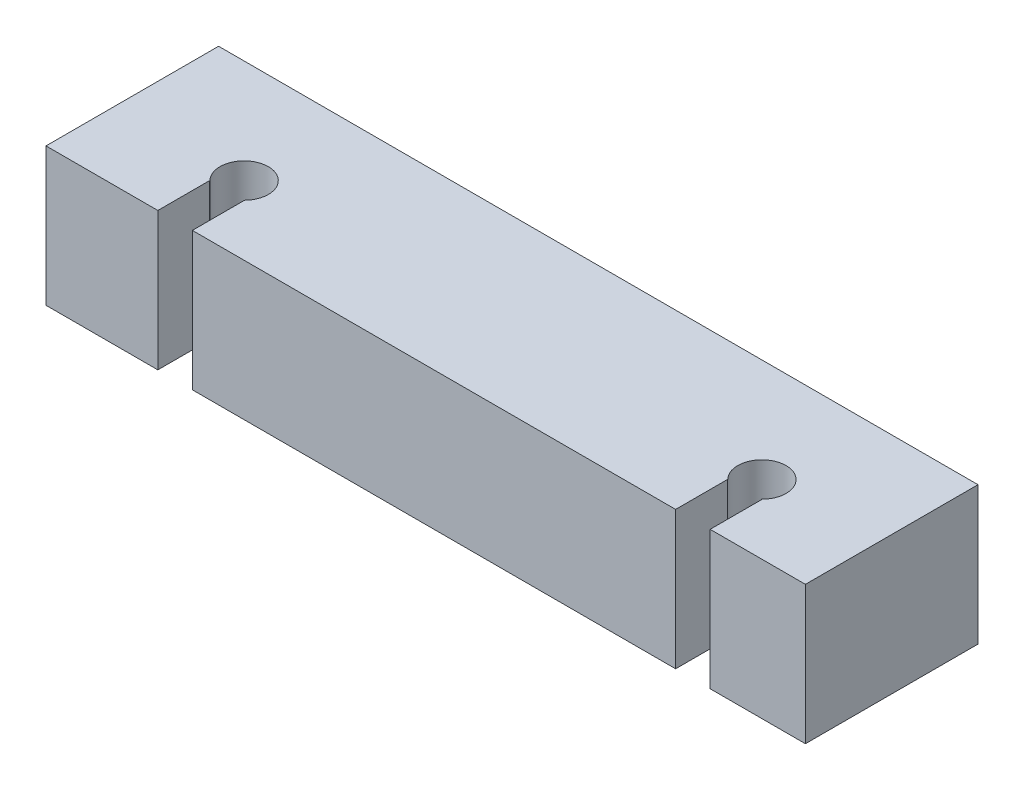
from build123d import *

# Parameters (mm, degrees)
SKETCH1_R               = 72.5
SKETCH1_R_2             = 62.5
BOSS_EXTRUDE1_DEPTH     = 10
SKETCH2_W               = 25
SKETCH2_H               = 10
BOSS_EXTRUDE2_DEPTH     = 100
SKETCH3_W               = 145
SKETCH3_H               = 50
BOSS_EXTRUDE3_DEPTH     = 10
CUT_EXTRUDE1_START      = -10
SKETCH4_R               = 62.5
CUT_EXTRUDE1_DEPTH      = 10
SKETCH5_W               = 145
SKETCH5_H               = 12.5
BOSS_EXTRUDE4_DEPTH     = 50
CUT_EXTRUDE2_DEPTH      = 138.318061449
CUT_EXTRUDE2_DEPTH_BACK = 138.318061449
SKETCH6_R               = 1.75
CUT_EXTRUDE3_DEPTH      = 138.318061449
CUT_EXTRUDE3_DEPTH_BACK = 138.318061449
SKETCH7_W               = 2.5
SKETCH7_H               = 7.5
SKETCH8_W               = 145
SKETCH8_H               = 12.5
CUT_EXTRUDE4_DEPTH      = 50
SKETCH9_W               = 145
SKETCH9_H               = 10
CUT_EXTRUDE5_DEPTH      = 87.5
SKETCH11_W              = 12.5
SKETCH11_H              = 10
CUT_EXTRUDE7_DEPTH      = 15
SKETCH13_W              = 12.5
SKETCH13_H              = 10
CUT_EXTRUDE9_DEPTH      = 50
SKETCH14_W              = 12.5
SKETCH14_H              = 10
CUT_EXTRUDE10_DEPTH     = 25


with BuildPart() as part:
    # Sketch1 → Boss-Extrude1 (new body)
    with BuildSketch(Plane(origin=(0, 0, 0), x_dir=(1, 0, 0), z_dir=(0, 1, 0))):
        with Locations(Location((0, 0, 0), (0, 0, 270))):
            Circle(SKETCH1_R)
        with Locations(Location((0, 0, 0), (0, 0, 270))):
            Circle(SKETCH1_R_2, mode=Mode.SUBTRACT)
    extrude(amount=BOSS_EXTRUDE1_DEPTH)

    # Sketch2 → Boss-Extrude2 (add)
    with BuildSketch(Plane.XY):
        with Locations((-60, 5)):
            Rectangle(SKETCH2_W, SKETCH2_H)
        with Locations((60, 5)):
            Rectangle(SKETCH2_W, SKETCH2_H)
    extrude(amount=BOSS_EXTRUDE2_DEPTH)

    # Sketch3 → Boss-Extrude3 (add)
    with BuildSketch(Plane(origin=(0, 10, 0), x_dir=(1, 0, 0), z_dir=(0, 1, 0))):
        with Locations((0, -75)):
            Rectangle(SKETCH3_W, SKETCH3_H)
    extrude(amount=-BOSS_EXTRUDE3_DEPTH)

    # Sketch4 → Cut-Extrude1 (cut)
    with BuildSketch(Plane(origin=(0, 10, 0), x_dir=(1, 0, 0), z_dir=(0, 1, 0)).offset(CUT_EXTRUDE1_START)):
        with Locations(Location((0, 0, 0), (0, 0, 270))):
            Circle(SKETCH4_R)
    extrude(amount=CUT_EXTRUDE1_DEPTH, mode=Mode.SUBTRACT)

    # Sketch5 → Boss-Extrude4 (add)
    with BuildSketch(Plane(origin=(0, 10, 0), x_dir=(1, 0, 0), z_dir=(0, 1, 0))):
        with Locations((0, -93.75)):
            Rectangle(SKETCH5_W, SKETCH5_H)
    extrude(amount=BOSS_EXTRUDE4_DEPTH)

    # Sketch6 → Cut-Extrude2 (cut, two sides: drawn at the far end of the back side and taken through both)
    with BuildSketch(Plane.XZ.offset(-CUT_EXTRUDE2_DEPTH_BACK)):
        with Locations(Location((-50.65, 95, 0), (0, 0, 270))):
            Circle(SKETCH6_R)
        with Locations(Location((-13.15, 95, 0), (0, 0, 270))):
            Circle(SKETCH6_R)
        with Locations(Location((24.35, 95, 0), (0, 0, 270))):
            Circle(SKETCH6_R)
        with Locations(Location((61.85, 95, 0), (0, 0, 270))):
            Circle(SKETCH6_R)
    extrude(amount=CUT_EXTRUDE2_DEPTH + CUT_EXTRUDE2_DEPTH_BACK, mode=Mode.SUBTRACT)

    # Sketch7 → Cut-Extrude3 (cut, two sides: drawn at the far end of the back side and taken through both)
    with BuildSketch(Plane.XZ.offset(-CUT_EXTRUDE3_DEPTH_BACK)):
        with Locations((-13.15, 100)):
            Rectangle(SKETCH7_W, SKETCH7_H)
        with Locations((-50.65, 100)):
            Rectangle(SKETCH7_W, SKETCH7_H)
        with Locations((24.35, 100)):
            Rectangle(SKETCH7_W, SKETCH7_H)
        with Locations((61.85, 100)):
            Rectangle(SKETCH7_W, SKETCH7_H)
    extrude(amount=CUT_EXTRUDE3_DEPTH + CUT_EXTRUDE3_DEPTH_BACK, mode=Mode.SUBTRACT)

    # Sketch8 → Cut-Extrude4 (cut)
    with BuildSketch(Plane(origin=(0, 60, 0), x_dir=(1, 0, 0), z_dir=(0, 1, 0))):
        with Locations((0, -93.75)):
            Rectangle(SKETCH8_W, SKETCH8_H)
    extrude(amount=-CUT_EXTRUDE4_DEPTH, mode=Mode.SUBTRACT)

    # Sketch9 → Cut-Extrude5 (cut, symmetric)
    with BuildSketch(Plane.XY):
        with Locations((0, 5)):
            Rectangle(SKETCH9_W, SKETCH9_H)
    extrude(amount=CUT_EXTRUDE5_DEPTH, both=True, mode=Mode.SUBTRACT)

    # Sketch11 → Cut-Extrude7 (cut)
    with BuildSketch(Plane(origin=(72.5, 0, 0), x_dir=(0, 0, -1), z_dir=(1, 0, 0))):
        with Locations((-93.75, 5)):
            Rectangle(SKETCH11_W, SKETCH11_H)
    extrude(amount=-CUT_EXTRUDE7_DEPTH, mode=Mode.SUBTRACT)

    # Sketch13 → Cut-Extrude9 (cut)
    with BuildSketch(Plane.ZY.offset(72.5)):
        with Locations((93.75, 5)):
            Rectangle(SKETCH13_W, SKETCH13_H)
    extrude(amount=-CUT_EXTRUDE9_DEPTH, mode=Mode.SUBTRACT)

    # Sketch14 → Cut-Extrude10 (cut)
    with BuildSketch(Plane(origin=(57.5, 0, 0), x_dir=(0, 0, -1), z_dir=(1, 0, 0))):
        with Locations((-93.75, 5)):
            Rectangle(SKETCH14_W, SKETCH14_H)
    extrude(amount=-CUT_EXTRUDE10_DEPTH, mode=Mode.SUBTRACT)


solid = part.part
